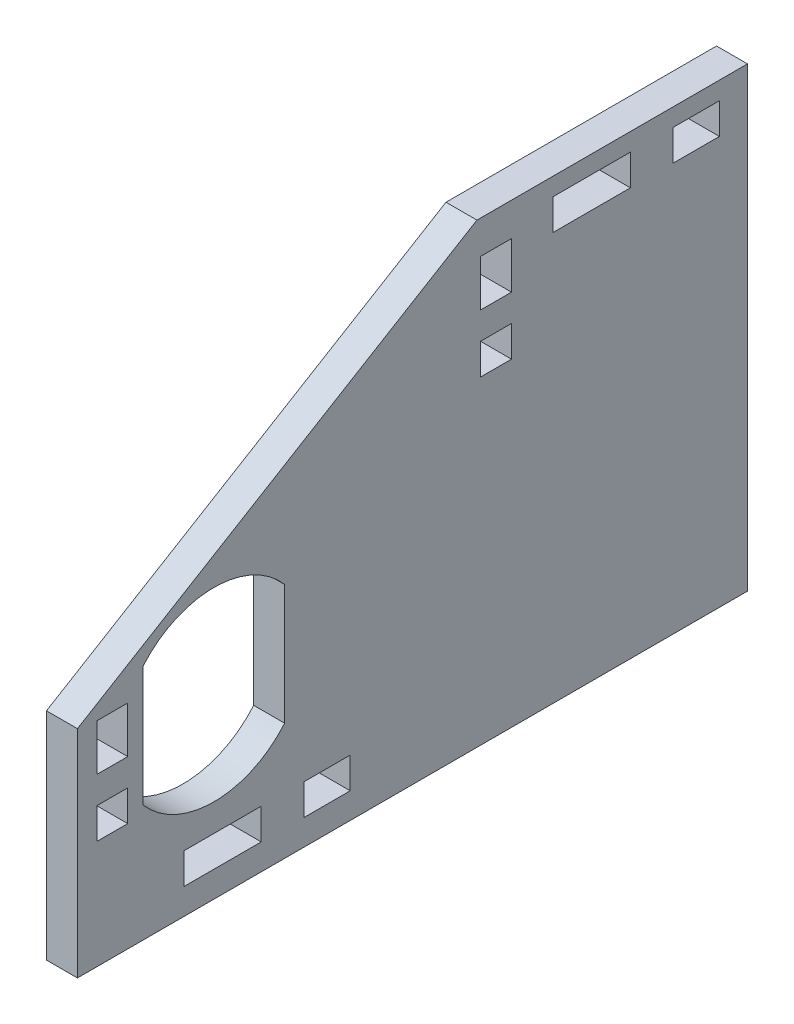
from build123d import *

# Parameters (mm, degrees)
SKETCH1_W           = 10
SKETCH1_H           = 4
SKETCH1_W_2         = 4
SKETCH1_H_2         = 6
SKETCH1_W_3         = 6
BOSS_EXTRUDE1_DEPTH = 4


with BuildPart() as part:
    # Sketch1 → Boss-Extrude1 (new body)
    with BuildSketch(Plane(origin=(0, 0, 0), x_dir=(0, 0, -1), z_dir=(1, 0, 0))):
        Polygon((-45.126561272, -21.465862465), (41.462435166, -21.465862465), (41.462435166, 37.538855), (6.497816801, 37.538855), (-45.126561272, 6.437068622), align=None)
        with Locations((21.33035671, 33.233983224)):
            Rectangle(SKETCH1_W, SKETCH1_H, mode=Mode.SUBTRACT)
        with Locations((-40.626561272, 3.062484248)):
            Rectangle(SKETCH1_W_2, SKETCH1_H_2, mode=Mode.SUBTRACT)
        with Locations((-40.626561272, -5.437515752)):
            Rectangle(SKETCH1_W_2, SKETCH1_H, mode=Mode.SUBTRACT)
        with Locations((-26.374737007, -16.111091518)):
            Rectangle(SKETCH1_W, SKETCH1_H, mode=Mode.SUBTRACT)
        with Locations((-12.874826786, -16.142516965)):
            Rectangle(SKETCH1_W_3, SKETCH1_H, mode=Mode.SUBTRACT)
        with Locations((34.83035671, 33.233983224)):
            Rectangle(SKETCH1_W_3, SKETCH1_H, mode=Mode.SUBTRACT)
        with Locations((8.963743124, 30.24228943)):
            Rectangle(SKETCH1_W_2, SKETCH1_H_2, mode=Mode.SUBTRACT)
        with Locations((8.963743124, 21.74228943)):
            Rectangle(SKETCH1_W_2, SKETCH1_H, mode=Mode.SUBTRACT)
        with BuildLine():
            Line((-36.652183199, -6.33954665), (-36.652183199, 9.188170503))
            ThreePointArc((-36.652183199, 9.188170503), (-27.502183199, 13.424311927), (-18.352183199, 9.188170503))
            Line((-18.352183199, 9.188170503), (-18.352183199, -6.33954665))
            ThreePointArc((-18.352183199, -6.33954665), (-27.502183199, -10.575688073), (-36.652183199, -6.33954665))
        make_face(mode=Mode.SUBTRACT)
    extrude(amount=BOSS_EXTRUDE1_DEPTH)


solid = part.part
